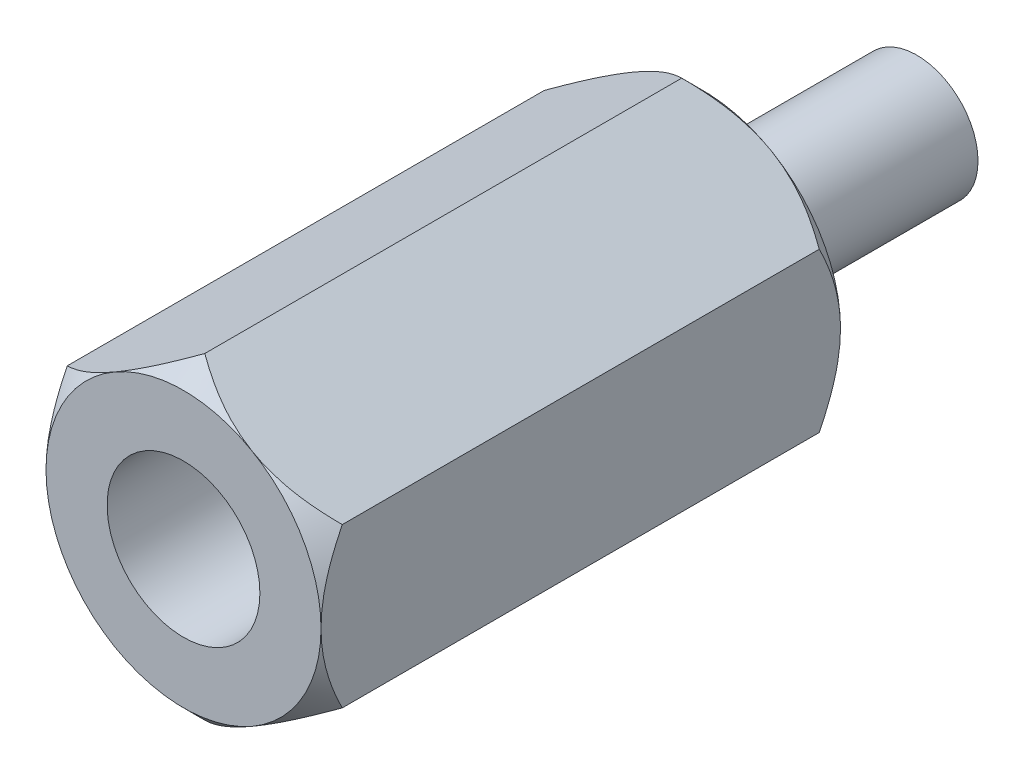
from build123d import *

# Parameters (mm, degrees)
SKETCH1_R           = 1
BOSS_EXTRUDE1_DEPTH = 3.5
BOSS_EXTRUDE2_DEPTH = 8.5
SKETCH3_R           = 1.25
CUT_EXTRUDE1_DEPTH  = 4.5
SKETCH4_OUTSIDE_W   = 36.23
SKETCH4_OUTSIDE_H   = 36.926
SKETCH4_OUTSIDE_R   = 2.25
CUT_EXTRUDE2_DEPTH  = 13.482487733
CUT_EXTRUDE2_DRAFT  = -45
SKETCH6_OUTSIDE_W   = 29.602
SKETCH6_OUTSIDE_H   = 30.298
SKETCH6_OUTSIDE_R   = 2.25
CUT_EXTRUDE3_DEPTH  = 10.16856041
CUT_EXTRUDE3_DRAFT  = -45


with BuildPart() as part:
    # Sketch1 → Boss-Extrude1 (new body)
    with BuildSketch(Plane.XY):
        Circle(SKETCH1_R)
    extrude(amount=BOSS_EXTRUDE1_DEPTH)

    # Sketch2 → Boss-Extrude2 (add)
    with BuildSketch(Plane.XY.offset(3.5)):
        Polygon((0, 2.598076211), (-2.25, 1.299038106), (-2.25, -1.299038106), (0, -2.598076211), (2.25, -1.299038106), (2.25, 1.299038106), align=None)
    extrude(amount=BOSS_EXTRUDE2_DEPTH)

    # Sketch3 → Cut-Extrude1 (cut)
    with BuildSketch(Plane.XY.offset(12)):
        Circle(SKETCH3_R)
    extrude(amount=-CUT_EXTRUDE1_DEPTH, mode=Mode.SUBTRACT)


with BuildPart() as cut_extrude2_tool:
    # Sketch4 outside → Cut-Extrude2 (with draft: the straight prism first)
    with BuildSketch(Plane.XY.offset(12)):
        Rectangle(SKETCH4_OUTSIDE_W, SKETCH4_OUTSIDE_H)
        Circle(SKETCH4_OUTSIDE_R, mode=Mode.SUBTRACT)
    extrude(amount=-CUT_EXTRUDE2_DEPTH)
    # Cut-Extrude2: the draft: its side faces are tilted about the plane it starts from
    cut_extrude2_sides = [cut_extrude2_tool.faces().sort_by_distance(p)[0] for p in [
        (0, -18.463, 5.258756134),
        (18.115, 0, 5.258756134),
        (0, 18.463, 5.258756134),
        (-18.115, 0, 5.258756134),
        (-2.25, 0, 5.258756134),
    ]]
    draft(cut_extrude2_sides, Plane.XY.offset(12), CUT_EXTRUDE2_DRAFT)


with BuildPart() as part_1:
    add(part.part)

    # Cut-Extrude2: cut by cut_extrude2_tool
    add(cut_extrude2_tool.part, mode=Mode.SUBTRACT)


with BuildPart() as cut_extrude3_tool:
    # Sketch6 outside → Cut-Extrude3 (with draft: the straight prism first)
    with BuildSketch(Plane(origin=(0, 0, 3.5), x_dir=(-1, 0, 0), z_dir=(0, 0, -1))):
        Rectangle(SKETCH6_OUTSIDE_W, SKETCH6_OUTSIDE_H)
        Circle(SKETCH6_OUTSIDE_R, mode=Mode.SUBTRACT)
    extrude(amount=-CUT_EXTRUDE3_DEPTH)
    # Cut-Extrude3: the draft: its side faces are tilted about the plane it starts from
    cut_extrude3_sides = [cut_extrude3_tool.faces().sort_by_distance(p)[0] for p in [
        (0, -15.149, 8.584280205),
        (-14.801, 0, 8.584280205),
        (0, 15.149, 8.584280205),
        (14.801, 0, 8.584280205),
        (2.25, 0, 8.584280205),
    ]]
    draft(cut_extrude3_sides, Plane(origin=(0, 0, 3.5), x_dir=(-1, 0, 0), z_dir=(0, 0, -1)), CUT_EXTRUDE3_DRAFT)


with BuildPart() as part_2:
    add(part_1.part)

    # Cut-Extrude3: cut by cut_extrude3_tool
    add(cut_extrude3_tool.part, mode=Mode.SUBTRACT)


solid = part_2.part
